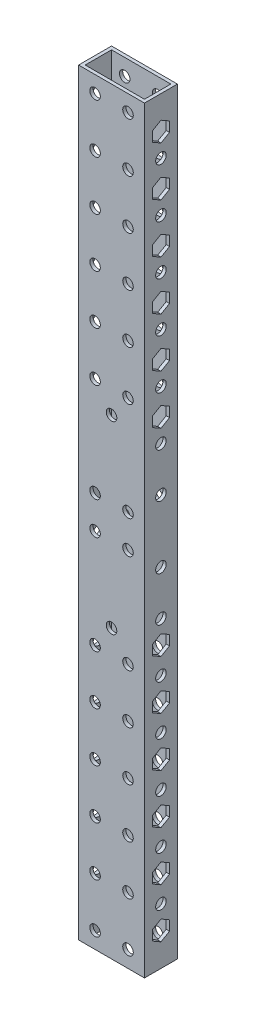
from build123d import *

# Parameters (mm, degrees)
SKETCH_1_W          = 20
SKETCH_1_H          = 10
SKETCH_1_W_2        = 18
SKETCH_1_H_2        = 8
EXTRUDE_1_DEPTH     = 230
SKETCH_3_R          = 1.6
CUT_EXTRUDE_1_DEPTH = 231.434372436
SKETCH_4_R          = 1.6
CUT_EXTRUDE_2_DEPTH = 231.922064775
SKETCH_5_R          = 1.6
CUT_EXTRUDE_3_DEPTH = 231.434372436


with BuildPart() as part:
    # 草图1 → 拉伸-薄壁1 (new body)
    with BuildSketch(Plane(origin=(0, 0, 0), x_dir=(1, 0, 0), z_dir=(0, 1, 0))):
        Rectangle(SKETCH_1_W, SKETCH_1_H)
        Rectangle(SKETCH_1_W_2, SKETCH_1_H_2, mode=Mode.SUBTRACT)
    extrude(amount=EXTRUDE_1_DEPTH)

    # 草图3 → 切除-拉伸1 (cut, through all)
    with BuildSketch(Plane.XY.offset(5)):
        with Locations((0, 143)):
            Circle(SKETCH_3_R)
        with Locations(Location((0, 87, 0), (0, 0, 180))):
            Circle(SKETCH_3_R)
        with Locations((-5, 225)):
            Circle(SKETCH_3_R)
        with Locations(Location((5, 225, 0), (0, 0, 180))):
            Circle(SKETCH_3_R)
        with Locations((-5, 210)):
            Circle(SKETCH_3_R)
        with Locations(Location((5, 210, 0), (0, 0, 180))):
            Circle(SKETCH_3_R)
        with Locations((-5, 195)):
            Circle(SKETCH_3_R)
        with Locations(Location((5, 195, 0), (0, 0, 180))):
            Circle(SKETCH_3_R)
        with Locations((-5, 180)):
            Circle(SKETCH_3_R)
        with Locations(Location((5, 180, 0), (0, 0, 180))):
            Circle(SKETCH_3_R)
        with Locations((-5, 165)):
            Circle(SKETCH_3_R)
        with Locations(Location((5, 165, 0), (0, 0, 180))):
            Circle(SKETCH_3_R)
        with Locations((-5, 150)):
            Circle(SKETCH_3_R)
        with Locations(Location((5, 150, 0), (0, 0, 180))):
            Circle(SKETCH_3_R)
        with Locations((5, 80)):
            Circle(SKETCH_3_R)
        with Locations(Location((-5, 80, 0), (0, 0, 180))):
            Circle(SKETCH_3_R)
        with Locations((5, 65)):
            Circle(SKETCH_3_R)
        with Locations(Location((-5, 65, 0), (0, 0, 180))):
            Circle(SKETCH_3_R)
        with Locations((5, 50)):
            Circle(SKETCH_3_R)
        with Locations(Location((-5, 50, 0), (0, 0, 180))):
            Circle(SKETCH_3_R)
        with Locations((5, 35)):
            Circle(SKETCH_3_R)
        with Locations(Location((-5, 35, 0), (0, 0, 180))):
            Circle(SKETCH_3_R)
        with Locations((5, 20)):
            Circle(SKETCH_3_R)
        with Locations(Location((-5, 20, 0), (0, 0, 180))):
            Circle(SKETCH_3_R)
        with Locations((5, 5)):
            Circle(SKETCH_3_R)
        with Locations(Location((-5, 5, 0), (0, 0, 180))):
            Circle(SKETCH_3_R)
    extrude(amount=-CUT_EXTRUDE_1_DEPTH, mode=Mode.SUBTRACT)

    # 草图4 → 切除-拉伸2 (cut, through all)
    with BuildSketch(Plane(origin=(10, 0, 0), x_dir=(0, 0, -1), z_dir=(1, 0, 0))):
        with Locations((0, 124.5)):
            Circle(SKETCH_4_R)
        with Locations((0, 105.5)):
            Circle(SKETCH_4_R)
        with Locations((0, 213)):
            Circle(SKETCH_4_R)
        with Locations((0, 198)):
            Circle(SKETCH_4_R)
        with Locations((0, 183)):
            Circle(SKETCH_4_R)
        with Locations((0, 168)):
            Circle(SKETCH_4_R)
        with Locations((0, 153)):
            Circle(SKETCH_4_R)
        with Locations((0, 138)):
            Circle(SKETCH_4_R)
        with Locations((0, 92)):
            Circle(SKETCH_4_R)
        with Locations((0, 77)):
            Circle(SKETCH_4_R)
        with Locations((0, 62)):
            Circle(SKETCH_4_R)
        with Locations((0, 47)):
            Circle(SKETCH_4_R)
        with Locations((0, 32)):
            Circle(SKETCH_4_R)
        with Locations((0, 17)):
            Circle(SKETCH_4_R)
        Polygon((0, 202), (2.598076211, 203.5), (2.598076211, 206.5), (0, 208), (-2.598076211, 206.5), (-2.598076211, 203.5), align=None)
        Polygon((0, 223), (-2.598076211, 221.5), (-2.598076211, 218.5), (0, 217), (2.598076211, 218.5), (2.598076211, 221.5), align=None)
        Polygon((0, 187), (2.598076211, 188.5), (2.598076211, 191.5), (0, 193), (-2.598076211, 191.5), (-2.598076211, 188.5), align=None)
        Polygon((0, 172), (2.598076211, 173.5), (2.598076211, 176.5), (0, 178), (-2.598076211, 176.5), (-2.598076211, 173.5), align=None)
        Polygon((0, 157), (2.598076211, 158.5), (2.598076211, 161.5), (0, 163), (-2.598076211, 161.5), (-2.598076211, 158.5), align=None)
        Polygon((0, 142), (2.598076211, 143.5), (2.598076211, 146.5), (0, 148), (-2.598076211, 146.5), (-2.598076211, 143.5), align=None)
        Polygon((2.598076211, 86.5), (2.598076211, 83.5), (0, 82), (-2.598076211, 83.5), (-2.598076211, 86.5), (0, 88), align=None)
        Polygon((2.598076211, 71.5), (2.598076211, 68.5), (0, 67), (-2.598076211, 68.5), (-2.598076211, 71.5), (0, 73), align=None)
        Polygon((2.598076211, 56.5), (2.598076211, 53.5), (0, 52), (-2.598076211, 53.5), (-2.598076211, 56.5), (0, 58), align=None)
        Polygon((2.598076211, 41.5), (2.598076211, 38.5), (0, 37), (-2.598076211, 38.5), (-2.598076211, 41.5), (0, 43), align=None)
        Polygon((2.598076211, 26.5), (2.598076211, 23.5), (0, 22), (-2.598076211, 23.5), (-2.598076211, 26.5), (0, 28), align=None)
        Polygon((2.598076211, 8.5), (0, 7), (-2.598076211, 8.5), (-2.598076211, 11.5), (0, 13), (2.598076211, 11.5), align=None)
    extrude(amount=-CUT_EXTRUDE_2_DEPTH, mode=Mode.SUBTRACT)

    # 草图5 → 切除-拉伸3 (cut, through all)
    with BuildSketch(Plane(origin=(0, 0, -5), x_dir=(-1, 0, 0), z_dir=(0, 0, -1))):
        with Locations((-5, 120)):
            Circle(SKETCH_5_R)
        with Locations((-5, 110)):
            Circle(SKETCH_5_R)
        with Locations((5, 110)):
            Circle(SKETCH_5_R)
        with Locations((5, 120)):
            Circle(SKETCH_5_R)
    extrude(amount=-CUT_EXTRUDE_3_DEPTH, mode=Mode.SUBTRACT)


solid = part.part
